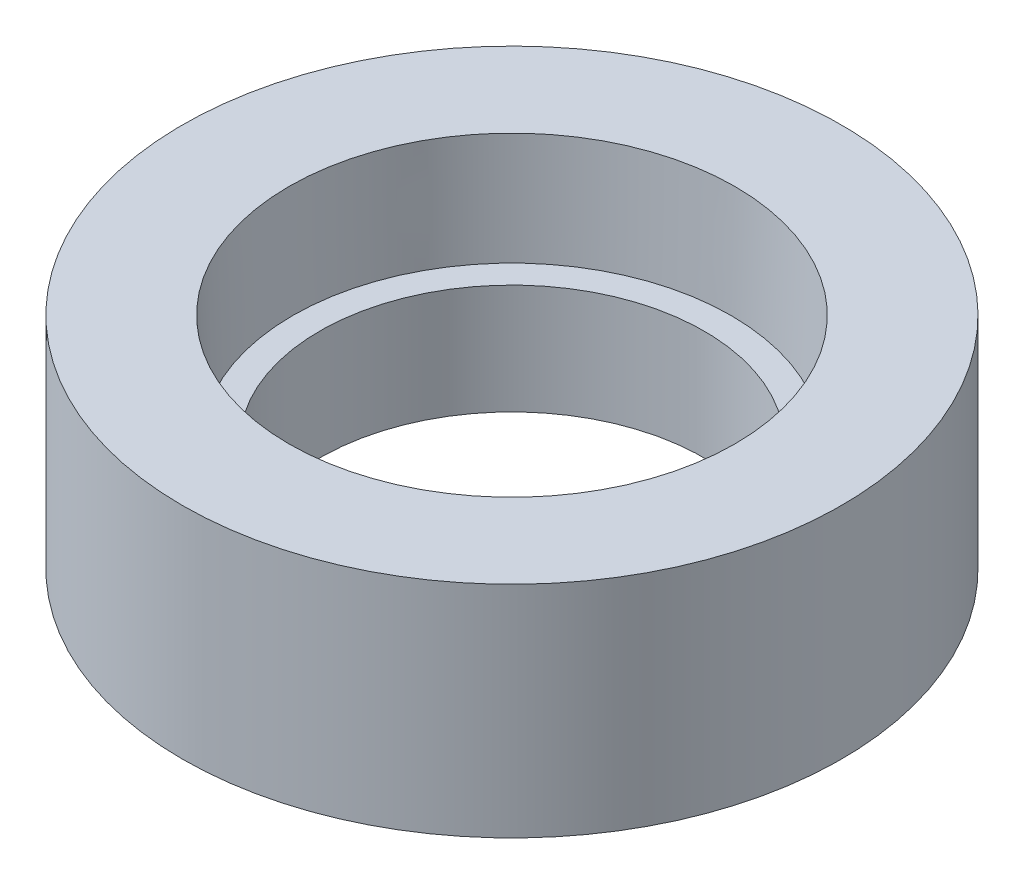
from build123d import *

# Parameters (mm, degrees)
SKETCH1_R           = 38.1
SKETCH1_R_2         = 22.225
BOSS_EXTRUDE1_DEPTH = 25.4
CUT_EXTRUDE1_START  = 12.7
SKETCH2_R           = 25.3365
CUT_EXTRUDE1_DEPTH  = 12.7
CUT_EXTRUDE1_DRAFT  = -2


with BuildPart() as part:
    # Sketch1 → Boss-Extrude1 (new body)
    with BuildSketch(Plane(origin=(0, 0, 0), x_dir=(1, 0, 0), z_dir=(0, 1, 0))):
        with Locations(Location((0, 0, 0), (0, 0, 270))):
            Circle(SKETCH1_R)
        with Locations(Location((0, 0, 0), (0, 0, 270))):
            Circle(SKETCH1_R_2, mode=Mode.SUBTRACT)
    extrude(amount=BOSS_EXTRUDE1_DEPTH)


with BuildPart() as cut_extrude1_tool:
    # Sketch2 → Cut-Extrude1 (with draft: the straight prism first)
    with BuildSketch(Plane(origin=(0, 0, 0), x_dir=(1, 0, 0), z_dir=(0, 1, 0)).offset(CUT_EXTRUDE1_START)):
        Circle(SKETCH2_R)
    extrude(amount=CUT_EXTRUDE1_DEPTH)
    # Cut-Extrude1: the draft: its side faces are tilted about the plane it starts from
    cut_extrude1_sides = [cut_extrude1_tool.faces().sort_by_distance(p)[0] for p in [
        (-25.3365, 19.05, 0),
    ]]
    draft(cut_extrude1_sides, Plane(origin=(0, 0, 0), x_dir=(1, 0, 0), z_dir=(0, 1, 0)).offset(CUT_EXTRUDE1_START), CUT_EXTRUDE1_DRAFT)


with BuildPart() as part_1:
    add(part.part)

    # Cut-Extrude1: cut by cut_extrude1_tool
    add(cut_extrude1_tool.part, mode=Mode.SUBTRACT)


solid = part_1.part
